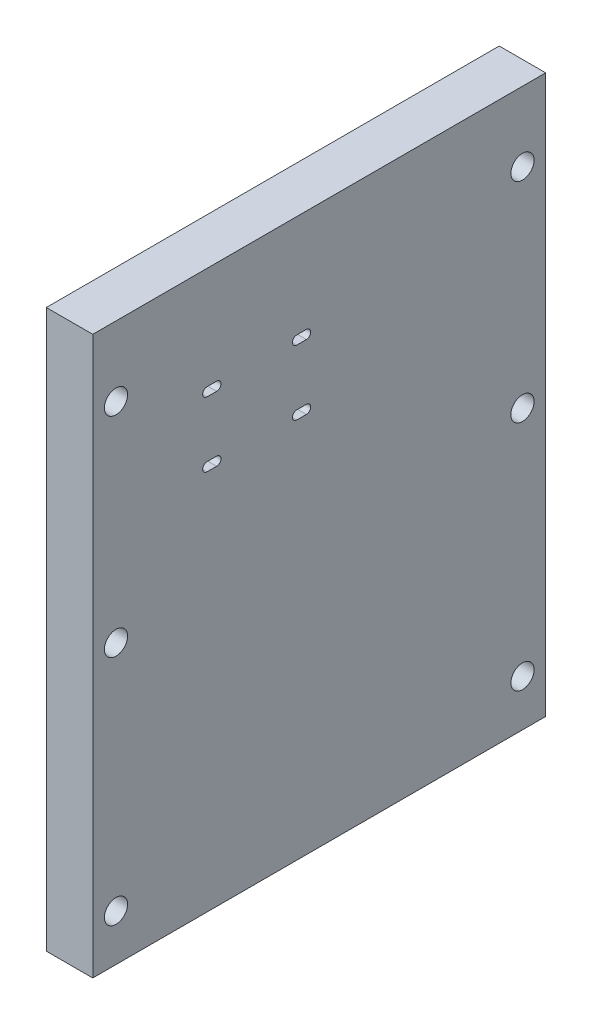
from build123d import *

# Parameters (mm, degrees)
SKETCH1_W           = 123.825
SKETCH1_H           = 152.4
SKETCH1_R           = 3.175
BOSS_EXTRUDE1_DEPTH = 12.7


with BuildPart() as part:
    # Sketch1 → Boss-Extrude1 (new body)
    with BuildSketch(Plane(origin=(0, 0, 0), x_dir=(0, 0, -1), z_dir=(1, 0, 0))):
        with Locations((39.6875, 0)):
            Rectangle(SKETCH1_W, SKETCH1_H)
        with Locations((-15.875, 57.15)):
            Circle(SKETCH1_R, mode=Mode.SUBTRACT)
        with Locations((-15.875, 0)):
            Circle(SKETCH1_R, mode=Mode.SUBTRACT)
        with Locations((95.25, 57.15)):
            Circle(SKETCH1_R, mode=Mode.SUBTRACT)
        with Locations((95.25, 0)):
            Circle(SKETCH1_R, mode=Mode.SUBTRACT)
        with Locations((-15.875, -63.5)):
            Circle(SKETCH1_R, mode=Mode.SUBTRACT)
        with Locations((95.25, -63.5)):
            Circle(SKETCH1_R, mode=Mode.SUBTRACT)
        with BuildLine():
            ThreePointArc((11.630324852, 30.43), (12.830324852, 29.23), (11.630324852, 28.03))
            Line((11.630324852, 28.03), (9.030324852, 28.03))
            ThreePointArc((9.030324852, 28.03), (7.830324852, 29.23), (9.030324852, 30.43))
            Line((9.030324852, 30.43), (11.630324852, 30.43))
        make_face(mode=Mode.SUBTRACT)
        with BuildLine():
            Line((36.170324852, 28.03), (33.570324852, 28.03))
            ThreePointArc((33.570324852, 28.03), (32.370324852, 29.23), (33.570324852, 30.43))
            Line((33.570324852, 30.43), (36.170324852, 30.43))
            ThreePointArc((36.170324852, 30.43), (37.370324852, 29.23), (36.170324852, 28.03))
        make_face(mode=Mode.SUBTRACT)
        with BuildLine():
            ThreePointArc((33.570324852, 45.77), (32.370324852, 46.97), (33.570324852, 48.17))
            Line((33.570324852, 48.17), (36.170324852, 48.17))
            ThreePointArc((36.170324852, 48.17), (37.370324852, 46.97), (36.170324852, 45.77))
            Line((36.170324852, 45.77), (33.570324852, 45.77))
        make_face(mode=Mode.SUBTRACT)
        with BuildLine():
            Line((9.030324852, 48.17), (11.630324852, 48.17))
            ThreePointArc((11.630324852, 48.17), (12.830324852, 46.97), (11.630324852, 45.77))
            Line((11.630324852, 45.77), (9.030324852, 45.77))
            ThreePointArc((9.030324852, 45.77), (7.830324852, 46.97), (9.030324852, 48.17))
        make_face(mode=Mode.SUBTRACT)
    extrude(amount=BOSS_EXTRUDE1_DEPTH)


solid = part.part
